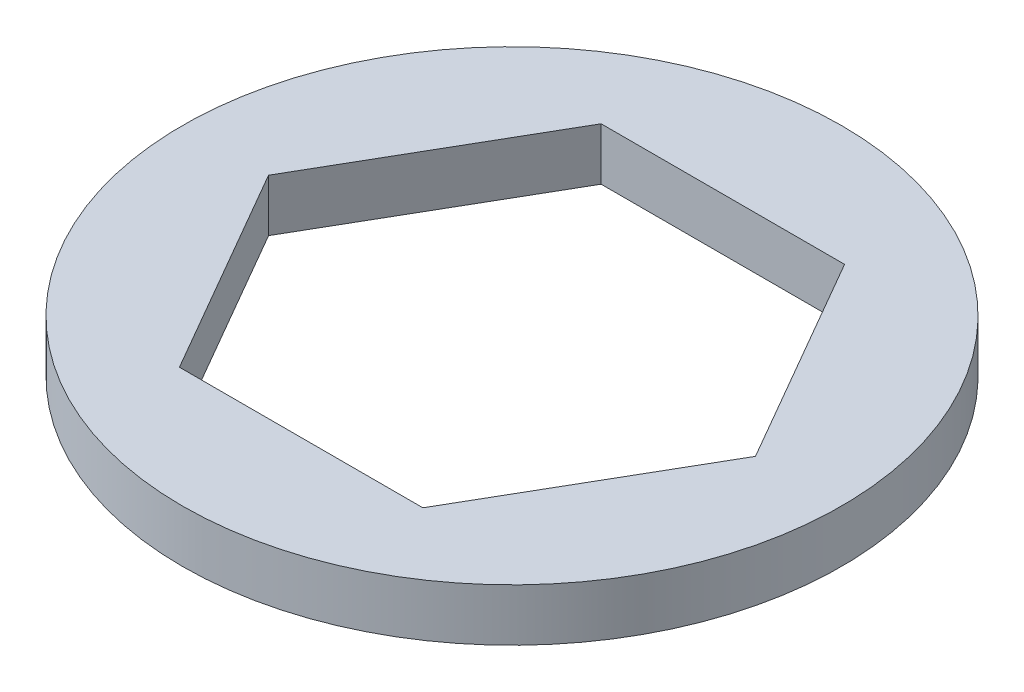
from build123d import *

# Parameters (mm, degrees)
SKETCH1_R           = 9.9949
BOSS_EXTRUDE1_DEPTH = 1.5875


with BuildPart() as part:
    # Sketch1 → Boss-Extrude1 (new body)
    with BuildSketch(Plane(origin=(0, 0, 0), x_dir=(1, 0, 0), z_dir=(0, 1, 0))):
        with Locations(Location((0, 0, 0), (0, 0, 270))):
            Circle(SKETCH1_R)
        Polygon((7.383674858, 0), (3.691837429, 6.39445), (-3.691837429, 6.39445), (-7.383674858, 0), (-3.691837429, -6.39445), (3.691837429, -6.39445), align=None, mode=Mode.SUBTRACT)
    extrude(amount=BOSS_EXTRUDE1_DEPTH)


solid = part.part
